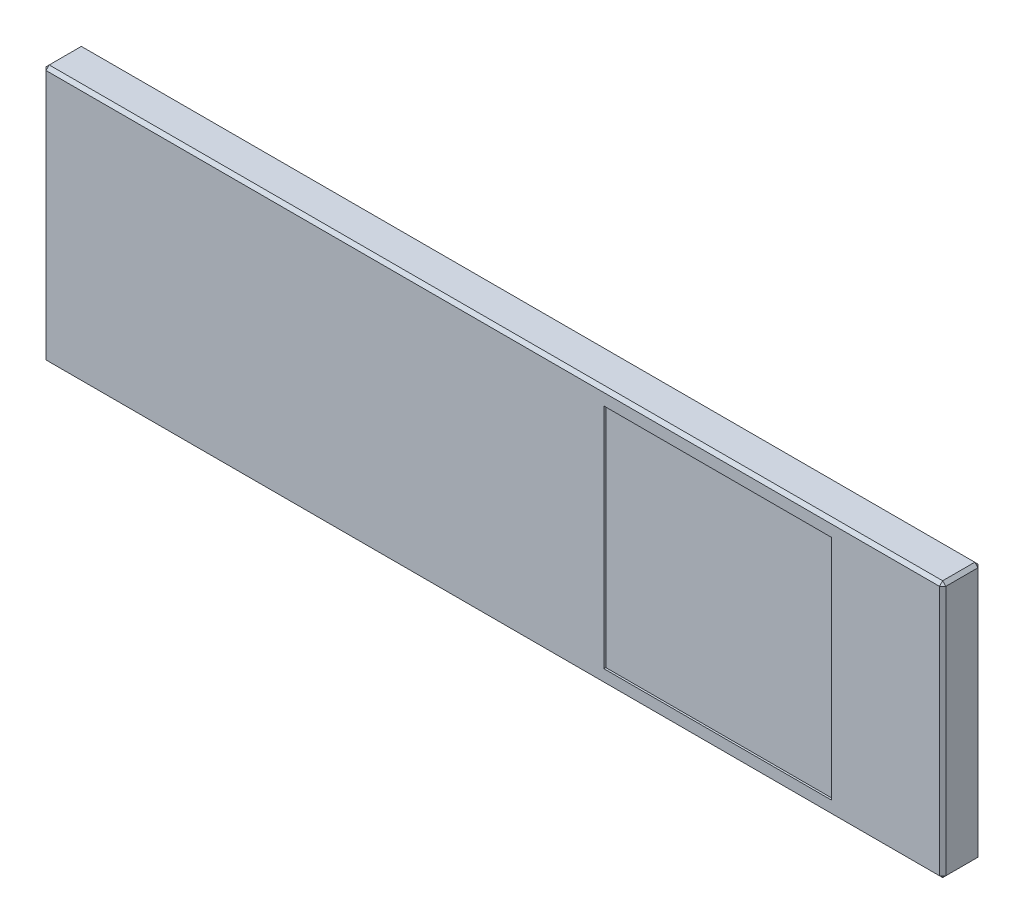
from build123d import *

# Parameters (mm, degrees)
CROQUIS1_W              = 140
CROQUIS1_H              = 40
SALIENTE_EXTRUIR1_DEPTH = 3
CHAFL_N1_SIZE           = 0.5
CROQUIS4_W              = 40
CROQUIS4_H              = 5
SALIENTE_EXTRUIR3_DEPTH = 18
CHAFL_N2_SIZE           = 1.5
REDONDEO1_R             = 2
CROQUIS5_R              = 2.15
CORTAR_EXTRUIR1_DEPTH   = 4.3
CROQUIS6_W              = 35.4
CROQUIS6_H              = 35.4
CORTAR_EXTRUIR3_DEPTH   = 0.3
CROQUIS7_W              = 35.4
CROQUIS7_H              = 35.4
CORTAR_EXTRUIR5_DEPTH   = 0.3
CORTAR_EXTRUIR6_DEPTH   = 0.4


with BuildPart() as part:
    # Croquis1 → Saliente-Extruir1 (new, symmetric)
    with BuildSketch(Plane.XY):
        with Locations((0, 20)):
            Rectangle(CROQUIS1_W, CROQUIS1_H)
    extrude(amount=SALIENTE_EXTRUIR1_DEPTH, both=True)

    # Chaflán1
    chafl_n1_edges = [part.edges().sort_by_distance(p)[0] for p in [
        (70, 20, 3),
        (0, 40, 3),
        (-70, 20, 3),
        (0, 40, -3),
        (70, 20, -3),
        (0, 0, -3),
        (-70, 20, -3),
        (-70, 40, 0),
        (70, 40, 0),
        (70, 0, 0),
        (-70, 0, 0),
        (0, 0, 3),
    ]]
    chamfer(chafl_n1_edges, length=CHAFL_N1_SIZE)

    # Croquis4 → Saliente-Extruir3 (add)
    with BuildSketch(Plane.XY.offset(-3)):
        with Locations((-35, 20)):
            Rectangle(CROQUIS4_W, CROQUIS4_H)
    extrude(amount=-SALIENTE_EXTRUIR3_DEPTH)

    # Chaflán2
    chafl_n2_edges = [part.edges().sort_by_distance(p)[0] for p in [
        (-55, 20, -21),
        (-35, 22.5, -21),
        (-15, 20, -21),
        (-35, 17.5, -21),
    ]]
    chamfer(chafl_n2_edges, length=CHAFL_N2_SIZE)

    # Redondeo1
    redondeo1_edges = [part.edges().sort_by_distance(p)[0] for p in [
        (-55, 20, -3),
        (-35, 17.5, -3),
        (-15, 20, -3),
        (-35, 22.5, -3),
    ]]
    fillet(redondeo1_edges, radius=REDONDEO1_R)

    # Croquis5 → Cortar-Extruir1 (cut)
    with BuildSketch(Plane(origin=(0, 0, 0), x_dir=(1, 0, 0), z_dir=(0, 1, 0))):
        with Locations(Location((-50, 0, 0), (0, 0, 90))):
            Circle(CROQUIS5_R)
        with Locations(Location((0, 0, 0), (0, 0, 90))):
            Circle(CROQUIS5_R)
        with Locations(Location((50, 0, 0), (0, 0, 90))):
            Circle(CROQUIS5_R)
    extrude(amount=CORTAR_EXTRUIR1_DEPTH, mode=Mode.SUBTRACT)

    # Croquis6 → Cortar-Extruir3 (cut)
    with BuildSketch(Plane.XY.offset(3)):
        with Locations((35, 20)):
            Rectangle(CROQUIS6_W, CROQUIS6_H)
    extrude(amount=-CORTAR_EXTRUIR3_DEPTH, mode=Mode.SUBTRACT)

    # Croquis7 → Cortar-Extruir5 (cut)
    with BuildSketch(Plane.XY.offset(-3)):
        with Locations((35, 20)):
            Rectangle(CROQUIS7_W, CROQUIS7_H)
    extrude(amount=CORTAR_EXTRUIR5_DEPTH, mode=Mode.SUBTRACT)

    # Croquis8 → Cortar-Extruir6 (cut)
    with BuildSketch(Plane.XY.offset(-3)):
        Polygon((-38, 9), (-32, 9), (-35, 3), align=None)
    extrude(amount=CORTAR_EXTRUIR6_DEPTH, mode=Mode.SUBTRACT)


solid = part.part
